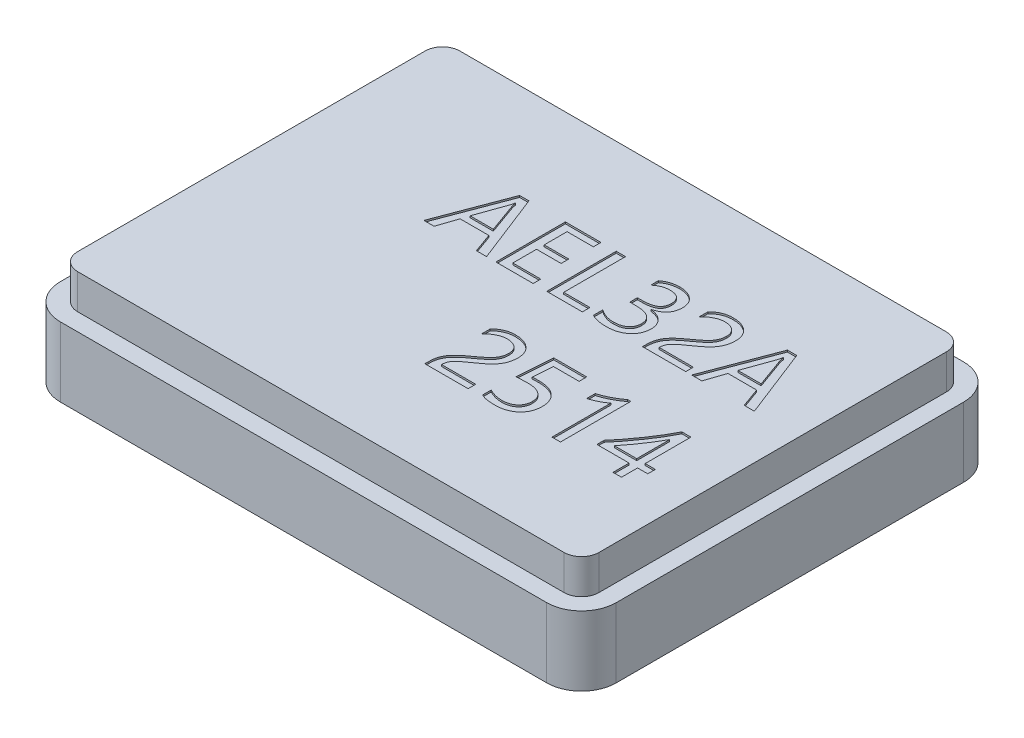
from build123d import *

# Parameters (mm, degrees)
SKETCH_1_W          = 3.2
SKETCH_1_H          = 2.4
EXTRUDE_1_DEPTH     = 0.4
FILLET_1_R          = 0.2
EXTRUDE_2_DEPTH     = 0.2
CUT_EXTRUDE_1_DEPTH = 0.01


with BuildPart() as part:
    # 草图1 → 凸台-拉伸1 (new body)
    with BuildSketch(Plane(origin=(0, 0, 0), x_dir=(1, 0, 0), z_dir=(0, 1, 0))):
        Rectangle(SKETCH_1_W, SKETCH_1_H)
    extrude(amount=EXTRUDE_1_DEPTH)

    # 圆角1
    fillet_1_edges = [part.edges().sort_by_distance(p)[0] for p in [
        (1.6, 0.2, 1.2),
        (-1.6, 0.2, 1.2),
        (-1.6, 0.2, -1.2),
        (1.6, 0.2, -1.2),
    ]]
    fillet(fillet_1_edges, radius=FILLET_1_R)


with BuildPart() as body_2:
    # 草图2 → 凸台-拉伸2 (new body)
    with BuildSketch(Plane(origin=(0, 0.4, 0), x_dir=(1, 0, 0), z_dir=(0, 1, 0))):
        with BuildLine():
            Line((1.4, 1.1), (-1.4, 1.1))
            ThreePointArc((-1.4, 1.1), (-1.470710678, 1.070710678), (-1.5, 1))
            Line((-1.5, 1), (-1.5, -1))
            ThreePointArc((-1.5, -1), (-1.470710678, -1.070710678), (-1.4, -1.1))
            Line((-1.4, -1.1), (1.4, -1.1))
            ThreePointArc((1.4, -1.1), (1.470710678, -1.070710678), (1.5, -1))
            Line((1.5, -1), (1.5, 1))
            ThreePointArc((1.5, 1), (1.470710678, 1.070710678), (1.4, 1.1))
        make_face()
    extrude(amount=EXTRUDE_2_DEPTH)

    # 草图3 → 切除-拉伸1 (cut)
    # profile 1 of 10: a face of its own
    with BuildSketch(Plane(origin=(0, 0.6, 0), x_dir=(1, 0, 0), z_dir=(0, 1, 0))):
        Polygon((-0.298157042, 0.151803805), (-0.356693628, 0.151803805), (-0.397166189, 0.263998927), (-0.562410091, 0.263998927), (-0.600596067, 0.151803805), (-0.659132652, 0.151803805), (-0.50791314, 0.551803805), (-0.454254603, 0.551803805), align=None)
        with BuildLine():
            Line((-0.415153994, 0.307901366), (-0.475367408, 0.474974537))
            add(Edge.make_bspline(
                [(-0.475367408, 0.474974537), (-0.47586657, 0.476570471), (-0.477005997, 0.480213475), (-0.47849912, 0.486501099), (-0.479963034, 0.49427456), (-0.48098651, 0.499948368), (-0.481541189, 0.503023317)],
                knots=[0, 0, 0, 0, 0.697926861, 1.593143037, 2.69559139, 4, 4, 4, 4], degree=3))
            Line((-0.481541189, 0.503023317), (-0.48283692, 0.503023317))
            add(Edge.make_bspline(
                [(-0.48283692, 0.503023317), (-0.483303353, 0.50017496), (-0.484184484, 0.494794177), (-0.485671879, 0.487254586), (-0.487327936, 0.480738662), (-0.48863479, 0.476797688), (-0.489239359, 0.474974537)],
                knots=[0, 0, 0, 0, 1.202164453, 2.270988586, 3.200134455, 4, 4, 4, 4], degree=3))
            Line((-0.489239359, 0.474974537), (-0.548919237, 0.307901366))
            Line((-0.548919237, 0.307901366), (-0.415153994, 0.307901366))
        make_face(mode=Mode.SUBTRACT)
    # profile 2 of 10: a face of its own
    with BuildSketch(Plane(origin=(0, 0.6, 0), x_dir=(1, 0, 0), z_dir=(0, 1, 0))):
        Polygon((-0.029864359, 0.151803805), (-0.244498506, 0.151803805), (-0.244498506, 0.551803805), (-0.039620457, 0.551803805), (-0.039620457, 0.507901366), (-0.190839969, 0.507901366), (-0.190839969, 0.376194049), (-0.049376555, 0.376194049), (-0.049376555, 0.33229161), (-0.190839969, 0.33229161), (-0.190839969, 0.195706244), (-0.029864359, 0.195706244), align=None)
    # profile 3 of 10: a face of its own
    with BuildSketch(Plane(origin=(0, 0.6, 0), x_dir=(1, 0, 0), z_dir=(0, 1, 0))):
        Polygon((0.25306247, 0.151803805), (0.048184421, 0.151803805), (0.048184421, 0.551803805), (0.101842958, 0.551803805), (0.101842958, 0.195706244), (0.25306247, 0.195706244), align=None)
    # profile 4 of 10: a face of its own
    with BuildSketch(Plane(origin=(0, 0.6, 0), x_dir=(1, 0, 0), z_dir=(0, 1, 0))):
        with BuildLine():
            add(Edge.make_bspline(
                [(0.301842958, 0.221316), (0.305230795, 0.218863595), (0.311949657, 0.21399991), (0.322695855, 0.207883942), (0.333689075, 0.202541484), (0.3450698, 0.198327024), (0.356719269, 0.194895321), (0.36871793, 0.192592202), (0.381046031, 0.191058886), (0.389389028, 0.190905713), (0.39361125, 0.190828195)],
                knots=[0, 0, 0, 0, 1.018907849, 2.020728909, 3.0097545, 3.995672016, 4.975794042, 5.967008838, 6.97114404, 8, 8, 8, 8], degree=3))
            add(Edge.make_bspline(
                [(0.39361125, 0.190828195), (0.396941798, 0.190883394), (0.403438176, 0.190991063), (0.412887602, 0.19192222), (0.421820191, 0.193412534), (0.430190164, 0.195651802), (0.438083987, 0.198377706), (0.445456103, 0.201696554), (0.452177124, 0.205825197), (0.458471141, 0.210355282), (0.464072899, 0.215499312), (0.46891534, 0.221131815), (0.473074222, 0.227123143), (0.476550571, 0.23353749), (0.479125609, 0.24045093), (0.480930275, 0.247742594), (0.482132471, 0.25542289), (0.482263611, 0.26069138), (0.482330763, 0.263389171)],
                knots=[0, 0, 0, 0, 1.237391587, 2.413586671, 3.524940726, 4.598973217, 5.629117843, 6.626151643, 7.596039385, 8.555346132, 9.504188761, 10.414580425, 11.3102643, 12.209969725, 13.118302896, 14.043409403, 14.998105528, 16, 16, 16, 16], degree=3))
            add(Edge.make_bspline(
                [(0.482330763, 0.263389171), (0.48223243, 0.266365125), (0.482040799, 0.272164717), (0.480858307, 0.280594607), (0.478687083, 0.288438167), (0.475755292, 0.295717694), (0.471842697, 0.302367407), (0.467202889, 0.308499993), (0.461652935, 0.314024829), (0.455236921, 0.318944284), (0.44798443, 0.323254669), (0.439900421, 0.327040354), (0.430946113, 0.330062859), (0.421232097, 0.3328244), (0.410602292, 0.334702428), (0.399159466, 0.336174121), (0.386864664, 0.336984683), (0.378393815, 0.337106699), (0.374022836, 0.337169659)],
                knots=[0, 0, 0, 0, 0.960329177, 1.871506488, 2.738548569, 3.580346455, 4.395789796, 5.220451182, 6.055114719, 6.914254795, 7.822403581, 8.772214742, 9.788465497, 10.868316271, 12.027484236, 13.266884428, 14.589705531, 16, 16, 16, 16], degree=3))
            Line((0.374022836, 0.337169659), (0.340867348, 0.337169659))
            Line((0.340867348, 0.337169659), (0.340867348, 0.381072098))
            Line((0.340867348, 0.381072098), (0.372346006, 0.381072098))
            add(Edge.make_bspline(
                [(0.372346006, 0.381072098), (0.376183133, 0.381143112), (0.38363635, 0.381281051), (0.394461488, 0.381985425), (0.404528124, 0.383399855), (0.413900077, 0.385160727), (0.422474785, 0.38761482), (0.430361499, 0.390490355), (0.437471548, 0.393987844), (0.443819364, 0.39807679), (0.449566017, 0.402524825), (0.45435015, 0.40773096), (0.4585674, 0.41332054), (0.461907451, 0.419553059), (0.464522549, 0.426312036), (0.466299419, 0.433592083), (0.467506153, 0.441372682), (0.46763174, 0.446742991), (0.467696616, 0.44951722)],
                knots=[0, 0, 0, 0, 1.378986105, 2.678536744, 3.894737667, 5.029840908, 6.102001862, 7.095696947, 8.042888106, 8.941912982, 9.805909328, 10.645493919, 11.474439363, 12.315957397, 13.177200233, 14.071717758, 15.003875647, 16, 16, 16, 16], degree=3))
            add(Edge.make_bspline(
                [(0.467696616, 0.44951722), (0.467634297, 0.45208531), (0.467513629, 0.457057929), (0.466694773, 0.464259749), (0.465230913, 0.47094032), (0.463251047, 0.477147006), (0.460757849, 0.482903726), (0.457619812, 0.488146389), (0.453798746, 0.492810876), (0.449581277, 0.497115808), (0.444672187, 0.500806224), (0.439237571, 0.503991179), (0.433255737, 0.506776282), (0.426666074, 0.508931417), (0.419541426, 0.510721884), (0.411831883, 0.51187594), (0.403562433, 0.512684597), (0.397856325, 0.512747106), (0.394906982, 0.512779415)],
                knots=[0, 0, 0, 0, 1.115706096, 2.1603527, 3.143287481, 4.082291381, 4.986729333, 5.863186415, 6.726830439, 7.60099085, 8.475220945, 9.385767539, 10.334003214, 11.335783872, 12.393239459, 13.521973606, 14.719170598, 16, 16, 16, 16], degree=3))
            add(Edge.make_bspline(
                [(0.394906982, 0.512779415), (0.391445915, 0.512701217), (0.384569086, 0.512545845), (0.374347766, 0.510992544), (0.364273745, 0.508689128), (0.354381419, 0.5052474), (0.344589019, 0.500999328), (0.335000252, 0.495702025), (0.325532452, 0.489497931), (0.319540222, 0.484729264), (0.316477104, 0.48229161)],
                knots=[0, 0, 0, 0, 0.966308682, 1.919968182, 2.882436745, 3.849917927, 4.841650648, 5.861363794, 6.906768647, 8, 8, 8, 8], degree=3))
            Line((0.316477104, 0.48229161), (0.316477104, 0.526194049))
            add(Edge.make_bspline(
                [(0.316477104, 0.526194049), (0.319761555, 0.528646976), (0.326288049, 0.533521159), (0.336824871, 0.539664355), (0.347697358, 0.544941571), (0.359001815, 0.549228331), (0.370694107, 0.552617912), (0.382843698, 0.554925243), (0.395376276, 0.556449859), (0.403870906, 0.556603906), (0.408169177, 0.556681854)],
                knots=[0, 0, 0, 0, 0.998464682, 1.984037429, 2.967272845, 3.941398137, 4.92726266, 5.930421157, 6.952795914, 8, 8, 8, 8], degree=3))
            add(Edge.make_bspline(
                [(0.408169177, 0.556681854), (0.412339821, 0.556627174), (0.420474028, 0.556520529), (0.432340741, 0.555152795), (0.44357693, 0.553116601), (0.454240674, 0.550334033), (0.464246446, 0.546593683), (0.473591289, 0.541980717), (0.482344587, 0.536633853), (0.49040438, 0.530491341), (0.497616078, 0.523628894), (0.503992327, 0.51630878), (0.509394981, 0.508474477), (0.513751026, 0.500087919), (0.517188124, 0.491246828), (0.519641387, 0.481917685), (0.521123781, 0.472100783), (0.521276923, 0.465376154), (0.521355153, 0.461941)],
                knots=[0, 0, 0, 0, 1.207049504, 2.354166446, 3.453682642, 4.511863091, 5.540793766, 6.540972158, 7.525113494, 8.506528938, 9.469237375, 10.402835245, 11.312920266, 12.217816856, 13.133149588, 14.053905864, 15.005873236, 16, 16, 16, 16], degree=3))
            add(Edge.make_bspline(
                [(0.521355153, 0.461941), (0.521306869, 0.45878759), (0.521212385, 0.452616766), (0.520170257, 0.443575437), (0.518596427, 0.434959013), (0.516386978, 0.426737857), (0.513511197, 0.418974884), (0.509927087, 0.411662681), (0.505881601, 0.404700117), (0.500985873, 0.398285212), (0.49558448, 0.392212375), (0.48945184, 0.386654982), (0.482693933, 0.381545672), (0.475360809, 0.376776689), (0.467317095, 0.372550383), (0.458701093, 0.368651256), (0.44943697, 0.365190369), (0.442964868, 0.3633444), (0.439647836, 0.362398317)],
                knots=[0, 0, 0, 0, 1.078243948, 2.109986227, 3.108883691, 4.072369768, 5.018371703, 5.935714359, 6.855359628, 7.767914107, 8.691043436, 9.632282612, 10.593531808, 11.586741823, 12.620970232, 13.69844333, 14.820423524, 16, 16, 16, 16], degree=3))
            add(Edge.make_bspline(
                [(0.439647836, 0.362398317), (0.443262487, 0.360945529), (0.450352438, 0.360039468), (0.460659141, 0.357923371), (0.470371486, 0.355059782), (0.479562835, 0.351717015), (0.488049338, 0.347430315), (0.496034687, 0.342668761), (0.503364615, 0.33711803), (0.510147965, 0.33104931), (0.516256391, 0.324437624), (0.521533883, 0.317325888), (0.525967828, 0.309799243), (0.529668189, 0.301929041), (0.532472099, 0.293634706), (0.534555058, 0.284968025), (0.535793622, 0.275874391), (0.53592336, 0.269668387), (0.535989299, 0.266514171)],
                knots=[0, 0, 0, 0, 1.168909043, 2.292754401, 3.371008523, 4.415679694, 5.42545447, 6.416600362, 7.394756461, 8.370225733, 9.333632249, 10.277565554, 11.205812271, 12.132088452, 13.062658604, 14.009684016, 14.988417328, 16, 16, 16, 16], degree=3))
            add(Edge.make_bspline(
                [(0.535989299, 0.266514171), (0.53587822, 0.262137515), (0.535660855, 0.253573023), (0.533778287, 0.241053805), (0.530738796, 0.229167271), (0.526468781, 0.217901801), (0.520931557, 0.207334984), (0.514245971, 0.197385028), (0.506267697, 0.188148269), (0.497121839, 0.179642403), (0.486998633, 0.171977148), (0.476052703, 0.16520104), (0.464242923, 0.159593136), (0.451684834, 0.154893682), (0.438271224, 0.151352882), (0.42408021, 0.148763543), (0.409091744, 0.147236745), (0.398848498, 0.147030968), (0.39361125, 0.146925756)],
                knots=[0, 0, 0, 0, 1.00420482, 1.965085639, 2.898676384, 3.81609665, 4.723882447, 5.631330964, 6.561856321, 7.519173022, 8.493150373, 9.47240413, 10.468856458, 11.489339795, 12.546124448, 13.648868621, 14.797894976, 16, 16, 16, 16], degree=3))
            add(Edge.make_bspline(
                [(0.39361125, 0.146925756), (0.388985124, 0.146973488), (0.379950304, 0.147066707), (0.366749778, 0.148106765), (0.354217984, 0.149649072), (0.342389368, 0.151961098), (0.331212135, 0.154810194), (0.320761401, 0.158429915), (0.310918525, 0.162551745), (0.30483714, 0.165973001), (0.301842958, 0.167657464)],
                knots=[0, 0, 0, 0, 1.166122442, 2.277436276, 3.336551785, 4.347864541, 5.314258108, 6.242048652, 7.134469036, 8, 8, 8, 8], degree=3))
            Line((0.301842958, 0.167657464), (0.301842958, 0.221316))
        make_face()
    # profile 5 of 10: a face of its own
    with BuildSketch(Plane(origin=(0, 0.6, 0), x_dir=(1, 0, 0), z_dir=(0, 1, 0))):
        with BuildLine():
            add(Edge.make_bspline(
                [(0.789647836, 0.445630025), (0.789599473, 0.4481745), (0.789504776, 0.453156804), (0.788467347, 0.460399496), (0.786915521, 0.46723983), (0.78457861, 0.473609765), (0.781690215, 0.479617214), (0.778085283, 0.48517939), (0.773872014, 0.490351113), (0.768958326, 0.494973782), (0.763551792, 0.499166948), (0.757668563, 0.502852793), (0.751285575, 0.50589546), (0.744471691, 0.508408143), (0.737186811, 0.510420661), (0.729421247, 0.511731679), (0.721197045, 0.51260511), (0.715564879, 0.512720187), (0.712666128, 0.512779415)],
                knots=[0, 0, 0, 0, 1.056493516, 2.068706555, 3.034034235, 3.965700842, 4.881624935, 5.798157171, 6.713229185, 7.646568874, 8.594657173, 9.55250989, 10.525140525, 11.527173638, 12.566921247, 13.660321224, 14.795819181, 16, 16, 16, 16], degree=3))
            add(Edge.make_bspline(
                [(0.712666128, 0.512779415), (0.708463197, 0.512635402), (0.69996664, 0.51234427), (0.687225724, 0.50984525), (0.674422556, 0.505857901), (0.661690508, 0.500254797), (0.64909256, 0.493322642), (0.636878754, 0.48496823), (0.625060571, 0.475252442), (0.617761774, 0.467901609), (0.61403808, 0.464151366)],
                knots=[0, 0, 0, 0, 0.892438729, 1.804135133, 2.748433758, 3.73736023, 4.75466059, 5.799871438, 6.877540064, 8, 8, 8, 8], degree=3))
            Line((0.61403808, 0.464151366), (0.61403808, 0.513084293))
            add(Edge.make_bspline(
                [(0.61403808, 0.513084293), (0.617384989, 0.516448202), (0.624007619, 0.523104471), (0.634852225, 0.53192873), (0.646490027, 0.539330895), (0.658761844, 0.545687388), (0.67196779, 0.550688878), (0.686225195, 0.554151967), (0.701520929, 0.556340405), (0.71209939, 0.556565828), (0.717544177, 0.556681854)],
                knots=[0, 0, 0, 0, 0.983052709, 1.945195957, 2.890199405, 3.836873689, 4.805049423, 5.808824637, 6.872191052, 8, 8, 8, 8], degree=3))
            add(Edge.make_bspline(
                [(0.717544177, 0.556681854), (0.721969123, 0.556600408), (0.73063779, 0.556440851), (0.743292988, 0.555006615), (0.755328613, 0.552881351), (0.766629914, 0.549623257), (0.777336073, 0.545615395), (0.787313633, 0.540545169), (0.796688565, 0.534671015), (0.805286833, 0.527885816), (0.813054013, 0.520354449), (0.819915491, 0.512169825), (0.825653503, 0.50327551), (0.830312523, 0.493744222), (0.834017498, 0.483613122), (0.836576859, 0.472818272), (0.838123403, 0.461376138), (0.83832498, 0.453536425), (0.838428324, 0.44951722)],
                knots=[0, 0, 0, 0, 1.165659335, 2.283579358, 3.352509362, 4.382528111, 5.378518292, 6.360617159, 7.326516104, 8.289556701, 9.241242913, 10.173056761, 11.097893164, 12.023117237, 12.96350264, 13.934585421, 14.941118791, 16, 16, 16, 16], degree=3))
            add(Edge.make_bspline(
                [(0.838428324, 0.44951722), (0.838379977, 0.445906729), (0.838284456, 0.438773314), (0.837222768, 0.42829453), (0.83574838, 0.418148546), (0.833539122, 0.408386225), (0.83062606, 0.3989964), (0.827119849, 0.389975101), (0.82299345, 0.381337695), (0.818211965, 0.373000311), (0.812637172, 0.364838535), (0.806233845, 0.356678359), (0.798859175, 0.348547722), (0.790685797, 0.340263326), (0.781544661, 0.33200719), (0.771516821, 0.323713362), (0.760700728, 0.315260092), (0.752988096, 0.309896652), (0.749022836, 0.307139171)],
                knots=[0, 0, 0, 0, 0.982770191, 1.941704783, 2.86532617, 3.773295145, 4.663914152, 5.540094637, 6.406524984, 7.268052773, 8.154551202, 9.09565156, 10.090161433, 11.141928465, 12.263462189, 13.442437348, 14.685092139, 16, 16, 16, 16], degree=3))
            add(Edge.make_bspline(
                [(0.749022836, 0.307139171), (0.74502728, 0.304379479), (0.737342697, 0.299071813), (0.726423869, 0.291303089), (0.716490108, 0.284224269), (0.707605346, 0.277742205), (0.699802514, 0.27178374), (0.692918867, 0.266562197), (0.687116812, 0.261920018), (0.680929447, 0.256652552), (0.674468387, 0.250515234), (0.667855879, 0.243302518), (0.662530221, 0.236200304), (0.658414723, 0.229099807), (0.655458922, 0.221668426), (0.653300038, 0.21369915), (0.652125171, 0.204937933), (0.651939366, 0.198859918), (0.651842958, 0.195706244)],
                knots=[0, 0, 0, 0, 1.505881014, 2.896234166, 4.155602516, 5.288659075, 6.306624478, 7.200142241, 7.96796157, 8.610611676, 9.719635667, 10.729273515, 11.641662871, 12.467445708, 13.266290447, 14.114874402, 15.021872832, 16, 16, 16, 16], degree=3))
            Line((0.651842958, 0.195706244), (0.848184421, 0.195706244))
            Line((0.848184421, 0.195706244), (0.848184421, 0.151803805))
            Line((0.848184421, 0.151803805), (0.599403933, 0.151803805))
            Line((0.599403933, 0.151803805), (0.599403933, 0.171620878))
            add(Edge.make_bspline(
                [(0.599403933, 0.171620878), (0.59952085, 0.17713854), (0.599746695, 0.187796889), (0.601470844, 0.203137611), (0.604429823, 0.217178888), (0.608571572, 0.230116603), (0.614235372, 0.242289066), (0.621369359, 0.254072685), (0.62996453, 0.265757842), (0.638439599, 0.275152268), (0.646017804, 0.282914275), (0.652695769, 0.288941732), (0.66001378, 0.295405731), (0.668179933, 0.302044365), (0.677003236, 0.309089291), (0.686652085, 0.31633552), (0.697073253, 0.323842354), (0.704302041, 0.32892009), (0.708016738, 0.331529415)],
                knots=[0, 0, 0, 0, 1.301735404, 2.514534667, 3.636202092, 4.682652211, 5.712626133, 6.796226652, 7.928068212, 9.129839025, 9.778404403, 10.486922114, 11.251617588, 12.082117295, 12.969658096, 13.915626098, 14.928891403, 16, 16, 16, 16], degree=3))
            add(Edge.make_bspline(
                [(0.708016738, 0.331529415), (0.711821563, 0.334196166), (0.719176196, 0.33935093), (0.729519681, 0.347247497), (0.73904735, 0.354759619), (0.747509251, 0.362145286), (0.755164493, 0.369158409), (0.761762377, 0.376018563), (0.767534626, 0.382568532), (0.772429447, 0.388968883), (0.776532057, 0.395408874), (0.780034815, 0.401964026), (0.783027748, 0.408709593), (0.785502582, 0.415654213), (0.787279244, 0.422867764), (0.788708213, 0.430261857), (0.789430838, 0.437892268), (0.789575128, 0.443037399), (0.789647836, 0.445630025)],
                knots=[0, 0, 0, 0, 1.519141936, 2.93646385, 4.254680188, 5.48560532, 6.608384985, 7.648317938, 8.596314735, 9.461999189, 10.280135729, 11.09038868, 11.890052435, 12.691440534, 13.497423121, 14.317034656, 15.151955661, 16, 16, 16, 16], degree=3))
        make_face()
    # profile 6 of 10: a face of its own
    with BuildSketch(Plane(origin=(0, 0.6, 0), x_dir=(1, 0, 0), z_dir=(0, 1, 0))):
        Polygon((1.243306372, 0.151803805), (1.184769787, 0.151803805), (1.144297226, 0.263998927), (0.979053324, 0.263998927), (0.940867348, 0.151803805), (0.882330763, 0.151803805), (1.033550275, 0.551803805), (1.087208811, 0.551803805), align=None)
        with BuildLine():
            Line((1.126309421, 0.307901366), (1.066096006, 0.474974537))
            add(Edge.make_bspline(
                [(1.066096006, 0.474974537), (1.065596844, 0.476570471), (1.064457418, 0.480213475), (1.062964294, 0.486501099), (1.061500381, 0.49427456), (1.060476904, 0.499948368), (1.059922226, 0.503023317)],
                knots=[0, 0, 0, 0, 0.697926861, 1.593143037, 2.69559139, 4, 4, 4, 4], degree=3))
            Line((1.059922226, 0.503023317), (1.058626494, 0.503023317))
            add(Edge.make_bspline(
                [(1.058626494, 0.503023317), (1.058160061, 0.50017496), (1.057278931, 0.494794177), (1.055791535, 0.487254586), (1.054135479, 0.480738662), (1.052828625, 0.476797688), (1.052224055, 0.474974537)],
                knots=[0, 0, 0, 0, 1.202164453, 2.270988586, 3.200134455, 4, 4, 4, 4], degree=3))
            Line((1.052224055, 0.474974537), (0.992544177, 0.307901366))
            Line((0.992544177, 0.307901366), (1.126309421, 0.307901366))
        make_face(mode=Mode.SUBTRACT)
    # profile 7 of 10: a face of its own
    with BuildSketch(Plane(origin=(0, 0.6, 0), x_dir=(1, 0, 0), z_dir=(0, 1, 0))):
        with BuildLine():
            add(Edge.make_bspline(
                [(0.248448659, -0.265928072), (0.248400296, -0.263383597), (0.248305599, -0.258401292), (0.24726817, -0.251158601), (0.245716344, -0.244318267), (0.243379433, -0.237948332), (0.240491038, -0.231940883), (0.236886106, -0.226378707), (0.232672837, -0.221206984), (0.227759149, -0.216584315), (0.222352615, -0.212391149), (0.216469386, -0.208705304), (0.210086397, -0.205662637), (0.203272514, -0.203149954), (0.195987633, -0.201137436), (0.188222069, -0.199826418), (0.179997868, -0.198952987), (0.174365702, -0.19883791), (0.171466951, -0.198778682)],
                knots=[0, 0, 0, 0, 1.056493516, 2.068706555, 3.034034235, 3.965700842, 4.881624935, 5.798157171, 6.713229185, 7.646568874, 8.594657173, 9.55250989, 10.525140525, 11.527173638, 12.566921247, 13.660321224, 14.795819181, 16, 16, 16, 16], degree=3))
            add(Edge.make_bspline(
                [(0.171466951, -0.198778682), (0.16726402, -0.198922695), (0.158767463, -0.199213827), (0.146026547, -0.201712847), (0.133223379, -0.205700196), (0.120491331, -0.2113033), (0.107893383, -0.218235455), (0.095679577, -0.226589867), (0.083861394, -0.236305655), (0.076562597, -0.243656488), (0.072838903, -0.247406731)],
                knots=[0, 0, 0, 0, 0.892438729, 1.804135133, 2.748433758, 3.73736023, 4.75466059, 5.799871438, 6.877540064, 8, 8, 8, 8], degree=3))
            Line((0.072838903, -0.247406731), (0.072838903, -0.198473804))
            add(Edge.make_bspline(
                [(0.072838903, -0.198473804), (0.076185812, -0.195109895), (0.082808442, -0.188453626), (0.093653048, -0.179629367), (0.10529085, -0.172227202), (0.117562667, -0.165870709), (0.130768613, -0.160869219), (0.145026018, -0.15740613), (0.160321752, -0.155217692), (0.170900213, -0.154992269), (0.176345, -0.154876243)],
                knots=[0, 0, 0, 0, 0.983052709, 1.945195957, 2.890199405, 3.836873689, 4.805049423, 5.808824637, 6.872191052, 8, 8, 8, 8], degree=3))
            add(Edge.make_bspline(
                [(0.176345, -0.154876243), (0.180769945, -0.154957689), (0.189438613, -0.155117246), (0.202093811, -0.156551482), (0.214129436, -0.158676746), (0.225430736, -0.16193484), (0.236136896, -0.165942702), (0.246114456, -0.171012928), (0.255489388, -0.176887082), (0.264087656, -0.183672281), (0.271854836, -0.191203648), (0.278716314, -0.199388272), (0.284454325, -0.208282587), (0.289113346, -0.217813875), (0.292818321, -0.227944975), (0.295377682, -0.238739825), (0.296924226, -0.250181959), (0.297125803, -0.258021672), (0.297229146, -0.262040877)],
                knots=[0, 0, 0, 0, 1.165659335, 2.283579358, 3.352509362, 4.382528111, 5.378518292, 6.360617159, 7.326516104, 8.289556701, 9.241242913, 10.173056761, 11.097893164, 12.023117237, 12.96350264, 13.934585421, 14.941118791, 16, 16, 16, 16], degree=3))
            add(Edge.make_bspline(
                [(0.297229146, -0.262040877), (0.2971808, -0.265651368), (0.297085278, -0.272784783), (0.296023591, -0.283263567), (0.294549203, -0.293409551), (0.292339945, -0.303171872), (0.289426883, -0.312561697), (0.285920672, -0.321582996), (0.281794273, -0.330220402), (0.277012788, -0.338557786), (0.271437995, -0.346719562), (0.265034668, -0.354879738), (0.257659998, -0.363010375), (0.249486619, -0.371294771), (0.240345484, -0.379550907), (0.230317644, -0.387844735), (0.219501551, -0.396298005), (0.211788919, -0.401661445), (0.207823659, -0.404418926)],
                knots=[0, 0, 0, 0, 0.982770191, 1.941704783, 2.86532617, 3.773295145, 4.663914152, 5.540094637, 6.406524984, 7.268052773, 8.154551202, 9.09565156, 10.090161433, 11.141928465, 12.263462189, 13.442437348, 14.685092139, 16, 16, 16, 16], degree=3))
            add(Edge.make_bspline(
                [(0.207823659, -0.404418926), (0.203828102, -0.407178618), (0.19614352, -0.412486284), (0.185224692, -0.420255008), (0.175290931, -0.427333828), (0.166406169, -0.433815892), (0.158603337, -0.439774357), (0.15171969, -0.4449959), (0.145917635, -0.449638079), (0.13973027, -0.454905545), (0.13326921, -0.461042863), (0.126656702, -0.468255579), (0.121331044, -0.475357793), (0.117215546, -0.48245829), (0.114259745, -0.489889671), (0.112100861, -0.497858947), (0.110925994, -0.506620164), (0.110740189, -0.512698179), (0.110643781, -0.515851853)],
                knots=[0, 0, 0, 0, 1.505881014, 2.896234166, 4.155602516, 5.288659075, 6.306624478, 7.200142241, 7.96796157, 8.610611676, 9.719635667, 10.729273515, 11.641662871, 12.467445708, 13.266290447, 14.114874402, 15.021872832, 16, 16, 16, 16], degree=3))
            Line((0.110643781, -0.515851853), (0.306985244, -0.515851853))
            Line((0.306985244, -0.515851853), (0.306985244, -0.559754292))
            Line((0.306985244, -0.559754292), (0.058204756, -0.559754292))
            Line((0.058204756, -0.559754292), (0.058204756, -0.539937219))
            add(Edge.make_bspline(
                [(0.058204756, -0.539937219), (0.058321673, -0.534419557), (0.058547518, -0.523761208), (0.060271667, -0.508420486), (0.063230646, -0.494379209), (0.067372395, -0.481441494), (0.073036195, -0.469269031), (0.080170182, -0.457485412), (0.088765353, -0.445800255), (0.097240422, -0.436405829), (0.104818627, -0.428643822), (0.111496592, -0.422616365), (0.118814603, -0.416152366), (0.126980756, -0.409513732), (0.135804059, -0.402468806), (0.145452908, -0.395222577), (0.155874076, -0.387715743), (0.163102864, -0.382638006), (0.166817561, -0.380028682)],
                knots=[0, 0, 0, 0, 1.301735404, 2.514534667, 3.636202092, 4.682652211, 5.712626133, 6.796226652, 7.928068212, 9.129839025, 9.778404403, 10.486922114, 11.251617588, 12.082117295, 12.969658096, 13.915626098, 14.928891403, 16, 16, 16, 16], degree=3))
            add(Edge.make_bspline(
                [(0.166817561, -0.380028682), (0.170622386, -0.377361931), (0.177977019, -0.372207167), (0.188320504, -0.3643106), (0.197848173, -0.356798478), (0.206310074, -0.349412811), (0.213965316, -0.342399688), (0.2205632, -0.335539534), (0.226335449, -0.328989565), (0.231230269, -0.322589214), (0.23533288, -0.316149223), (0.238835638, -0.309594071), (0.241828571, -0.302848504), (0.244303405, -0.295903884), (0.246080067, -0.288690333), (0.247509036, -0.28129624), (0.24823166, -0.273665829), (0.248375951, -0.268520698), (0.248448659, -0.265928072)],
                knots=[0, 0, 0, 0, 1.519141936, 2.93646385, 4.254680188, 5.48560532, 6.608384985, 7.648317938, 8.596314735, 9.461999189, 10.280135729, 11.09038868, 11.890052435, 12.691440534, 13.497423121, 14.317034656, 15.151955661, 16, 16, 16, 16], degree=3))
        make_face()
    # profile 8 of 10: a face of its own
    with BuildSketch(Plane(origin=(0, 0.6, 0), x_dir=(1, 0, 0), z_dir=(0, 1, 0))):
        with BuildLine():
            add(Edge.make_bspline(
                [(0.609424268, -0.435211609), (0.609313108, -0.43994362), (0.609095296, -0.449215683), (0.60721149, -0.462768604), (0.604211099, -0.475664678), (0.599818224, -0.487802935), (0.594331407, -0.499298569), (0.587464198, -0.509975861), (0.579527761, -0.520065446), (0.570280201, -0.52922229), (0.560083275, -0.537543477), (0.54896163, -0.544802674), (0.53704312, -0.551032767), (0.524185361, -0.555971508), (0.510530053, -0.559834369), (0.496029393, -0.562664055), (0.480704606, -0.564356225), (0.470200963, -0.564538988), (0.464835854, -0.564632341)],
                knots=[0, 0, 0, 0, 1.038164429, 2.034214658, 2.997233558, 3.939129121, 4.861930507, 5.787020473, 6.719742937, 7.673971107, 8.63719987, 9.603860661, 10.584050106, 11.583357422, 12.62125224, 13.695192892, 14.822737847, 16, 16, 16, 16], degree=3))
            add(Edge.make_bspline(
                [(0.464835854, -0.564632341), (0.460261504, -0.564597947), (0.451385435, -0.564531209), (0.438543974, -0.563749981), (0.426591193, -0.562540224), (0.415534801, -0.560914873), (0.405379846, -0.558700829), (0.396097219, -0.556047132), (0.387696174, -0.552925371), (0.382597787, -0.550276152), (0.380155976, -0.549007341)],
                knots=[0, 0, 0, 0, 1.262385657, 2.449533769, 3.549188029, 4.577605264, 5.532151448, 6.415420393, 7.241084701, 8, 8, 8, 8], degree=3))
            Line((0.380155976, -0.549007341), (0.380155976, -0.499998194))
            add(Edge.make_bspline(
                [(0.380155976, -0.499998194), (0.383514598, -0.501669124), (0.390169283, -0.504979859), (0.400412974, -0.50911238), (0.410638297, -0.512759672), (0.420963881, -0.515627454), (0.431311278, -0.517948905), (0.441730022, -0.519518627), (0.452186852, -0.520576541), (0.459193006, -0.520678727), (0.462701707, -0.520729902)],
                knots=[0, 0, 0, 0, 1.047486704, 2.075462357, 3.083249586, 4.078565337, 5.066949607, 6.043568961, 7.0202141, 8, 8, 8, 8], degree=3))
            add(Edge.make_bspline(
                [(0.462701707, -0.520729902), (0.466108296, -0.520646223), (0.472758131, -0.520482879), (0.482476514, -0.519516341), (0.491690598, -0.517771699), (0.500366297, -0.515227541), (0.508615681, -0.512125146), (0.516317155, -0.508218478), (0.523525076, -0.503632401), (0.530156116, -0.498360548), (0.536167622, -0.49254213), (0.541386138, -0.486157747), (0.545834044, -0.479335502), (0.549522761, -0.472064483), (0.552359288, -0.464310899), (0.554304505, -0.456096013), (0.555581729, -0.447446763), (0.555703531, -0.441517138), (0.555765732, -0.438489048)],
                knots=[0, 0, 0, 0, 1.169775658, 2.283461802, 3.349348441, 4.384667205, 5.38427129, 6.371310876, 7.344138773, 8.31281178, 9.275179281, 10.21120959, 11.137925121, 12.066445516, 13.004790073, 13.965376693, 14.960975861, 16, 16, 16, 16], degree=3))
            add(Edge.make_bspline(
                [(0.555765732, -0.438489048), (0.555711844, -0.435459832), (0.555606702, -0.429549475), (0.554227439, -0.42097961), (0.552225968, -0.412871463), (0.549222502, -0.405343196), (0.545466873, -0.398269024), (0.540744642, -0.391810799), (0.535352657, -0.385696559), (0.528939512, -0.380324477), (0.521885751, -0.375445626), (0.51408517, -0.371224072), (0.505635122, -0.367657542), (0.4964681, -0.364765548), (0.486634844, -0.362474776), (0.476079047, -0.360929273), (0.464856557, -0.359893436), (0.457140181, -0.359801529), (0.453174268, -0.359754292)],
                knots=[0, 0, 0, 0, 0.99272704, 1.936926984, 2.840561303, 3.727434335, 4.588876569, 5.460898877, 6.346203886, 7.256578408, 8.197535443, 9.156084033, 10.160775423, 11.20196967, 12.305862844, 13.469319152, 14.699329797, 16, 16, 16, 16], degree=3))
            add(Edge.make_bspline(
                [(0.453174268, -0.359754292), (0.447025398, -0.359802547), (0.435054867, -0.35989649), (0.417542545, -0.360499356), (0.400969252, -0.361538584), (0.390239816, -0.362595263), (0.385034024, -0.36310795)],
                knots=[0, 0, 0, 0, 1.081060347, 2.104592606, 3.080371503, 4, 4, 4, 4], degree=3))
            Line((0.385034024, -0.36310795), (0.399973049, -0.159754292))
            Line((0.399973049, -0.159754292), (0.589912073, -0.159754292))
            Line((0.589912073, -0.159754292), (0.589912073, -0.203656731))
            Line((0.589912073, -0.203656731), (0.442274878, -0.203656731))
            Line((0.442274878, -0.203656731), (0.433814512, -0.317376243))
            Line((0.433814512, -0.317376243), (0.470857195, -0.315851853))
            add(Edge.make_bspline(
                [(0.470857195, -0.315851853), (0.476120728, -0.315919805), (0.486366581, -0.316052078), (0.501261477, -0.317648323), (0.515310599, -0.320044819), (0.528504236, -0.323453732), (0.540846067, -0.327859472), (0.55225638, -0.333322116), (0.562889999, -0.339640754), (0.572526281, -0.347062648), (0.581297194, -0.3552461), (0.58874845, -0.364425877), (0.595272386, -0.374213379), (0.60045279, -0.384924533), (0.604487473, -0.39640942), (0.607391718, -0.408668109), (0.609053615, -0.421700517), (0.609298682, -0.430633721), (0.609424268, -0.435211609)],
                knots=[0, 0, 0, 0, 1.218679116, 2.372248176, 3.465519652, 4.517479775, 5.524548886, 6.495855075, 7.443537969, 8.383975825, 9.308106099, 10.215311382, 11.116292035, 12.026926498, 12.963138392, 13.930908325, 14.939678235, 16, 16, 16, 16], degree=3))
        make_face()
    # profile 9 of 10: a face of its own
    with BuildSketch(Plane(origin=(0, 0.6, 0), x_dir=(1, 0, 0), z_dir=(0, 1, 0))):
        with BuildLine():
            Line((0.789912073, -0.559754292), (0.789912073, -0.219967706))
            add(Edge.make_bspline(
                [(0.789912073, -0.219967706), (0.787644614, -0.222055724), (0.782651294, -0.226653884), (0.773401996, -0.232869182), (0.762363797, -0.239805965), (0.7495703, -0.24662016), (0.736138381, -0.253312388), (0.722699103, -0.258871318), (0.70989268, -0.26369499), (0.701365765, -0.265968452), (0.697229146, -0.267071365)],
                knots=[0, 0, 0, 0, 0.704945565, 1.552406624, 2.545318557, 3.69082532, 4.869537831, 5.980344412, 7.020214797, 8, 8, 8, 8], degree=3))
            Line((0.697229146, -0.267071365), (0.697229146, -0.218290877))
            add(Edge.make_bspline(
                [(0.697229146, -0.218290877), (0.702617018, -0.216719614), (0.713674537, -0.213494913), (0.730193129, -0.206962184), (0.747390793, -0.199593586), (0.764551568, -0.190846517), (0.781021257, -0.181778081), (0.795870632, -0.172707897), (0.808687198, -0.163953005), (0.816195632, -0.157772349), (0.819713903, -0.154876243)],
                knots=[0, 0, 0, 0, 0.96993373, 1.990593425, 3.068734014, 4.204309626, 5.319269746, 6.319096776, 7.212369491, 8, 8, 8, 8], degree=3))
            Line((0.819713903, -0.154876243), (0.838692561, -0.154876243))
            Line((0.838692561, -0.154876243), (0.838692561, -0.559754292))
            Line((0.838692561, -0.559754292), (0.789912073, -0.559754292))
        make_face()
    # profile 10 of 10: a face of its own
    with BuildSketch(Plane(origin=(0, 0.6, 0), x_dir=(1, 0, 0), z_dir=(0, 1, 0))):
        with BuildLine():
            Line((1.189912073, -0.159754292), (1.189912073, -0.423168926))
            Line((1.189912073, -0.423168926), (1.248448659, -0.423168926))
            Line((1.248448659, -0.423168926), (1.248448659, -0.467071365))
            Line((1.248448659, -0.467071365), (1.189912073, -0.467071365))
            Line((1.189912073, -0.467071365), (1.189912073, -0.559754292))
            Line((1.189912073, -0.559754292), (1.141131585, -0.559754292))
            Line((1.141131585, -0.559754292), (1.141131585, -0.467071365))
            Line((1.141131585, -0.467071365), (0.955765732, -0.467071365))
            Line((0.955765732, -0.467071365), (0.955765732, -0.425455511))
            add(Edge.make_bspline(
                [(0.955765732, -0.425455511), (0.964093972, -0.415860594), (0.981133563, -0.396229383), (1.005871941, -0.365005839), (1.030729506, -0.331700704), (1.051274111, -0.302701945), (1.06737132, -0.278797343), (1.079116035, -0.261022731), (1.090233192, -0.243466031), (1.100853982, -0.226228794), (1.110916312, -0.209268636), (1.120358381, -0.192514459), (1.129387497, -0.176119124), (1.13500929, -0.165154286), (1.137777927, -0.159754292)],
                knots=[0, 0, 0, 0, 1.416740294, 2.898652394, 4.441123769, 6.05109865, 6.86129983, 7.654998932, 8.426874509, 9.17862826, 9.912856759, 10.625918725, 11.323288568, 12, 12, 12, 12], degree=3))
            Line((1.137777927, -0.159754292), (1.189912073, -0.159754292))
        make_face()
        with BuildLine():
            Line((1.012396829, -0.423168926), (1.141131585, -0.423168926))
            Line((1.141131585, -0.423168926), (1.141131585, -0.233153682))
            add(Edge.make_bspline(
                [(1.141131585, -0.233153682), (1.136649345, -0.2411545), (1.12771178, -0.257108089), (1.113605556, -0.280594016), (1.099167209, -0.30378958), (1.08401154, -0.32674093), (1.067994269, -0.349929563), (1.050765402, -0.373691014), (1.032150231, -0.398254294), (1.019084993, -0.414733258), (1.012396829, -0.423168926)],
                knots=[0, 0, 0, 0, 0.957687981, 1.909624916, 2.860807221, 3.810856455, 4.781631678, 5.803821085, 6.875764471, 8, 8, 8, 8], degree=3))
        make_face(mode=Mode.SUBTRACT)
    extrude(amount=-CUT_EXTRUDE_1_DEPTH, mode=Mode.SUBTRACT)


solid = Compound([part.part, body_2.part])
